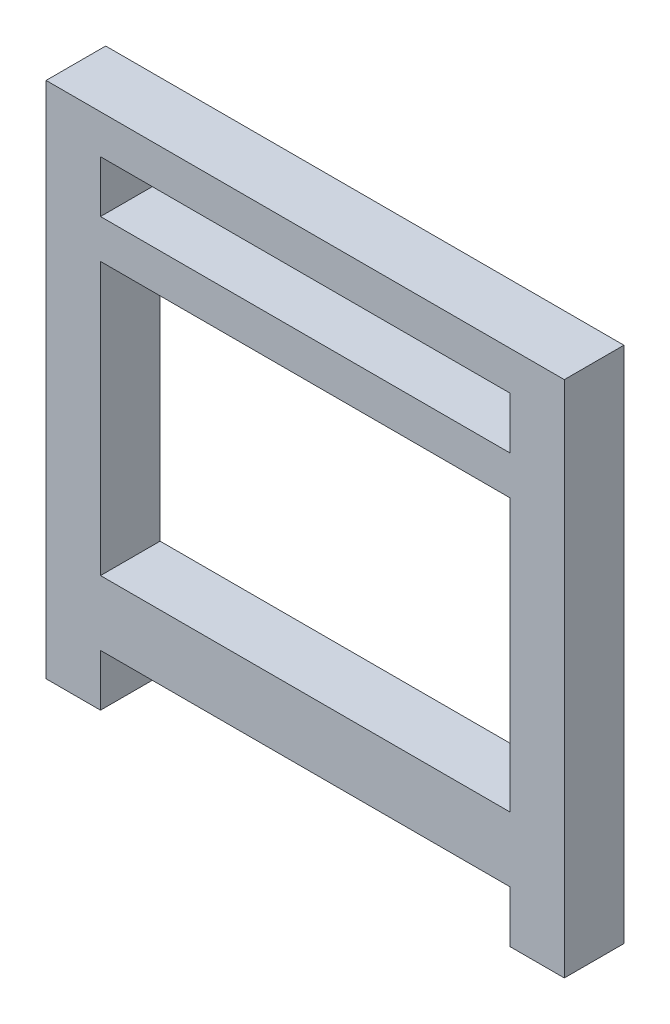
from build123d import *

# Parameters (mm, degrees)
SKETCH1_W           = 15.8
SKETCH1_H           = 10.5
SKETCH1_H_2         = 2
BOSS_EXTRUDE1_DEPTH = 2.3


with BuildPart() as part:
    # Sketch1 → Boss-Extrude1 (new body)
    with BuildSketch(Plane.XY):
        Polygon((0, 0), (0, -2), (2.1, -2), (2.1, 0), (17.9, 0), (17.9, -2), (20, -2), (20, 0), (20, 18), (0, 18), align=None)
        with Locations((10, 7.75)):
            Rectangle(SKETCH1_W, SKETCH1_H, mode=Mode.SUBTRACT)
        with Locations((10, 15.5)):
            Rectangle(SKETCH1_W, SKETCH1_H_2, mode=Mode.SUBTRACT)
    extrude(amount=BOSS_EXTRUDE1_DEPTH)


solid = part.part
